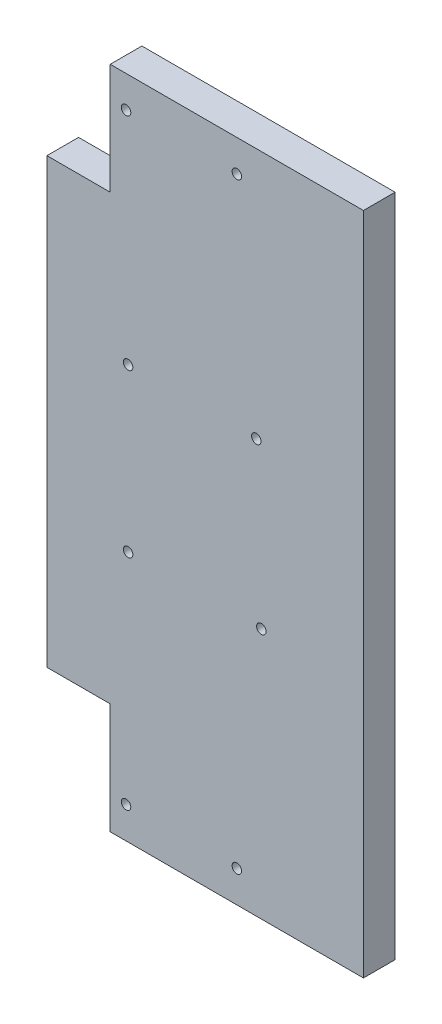
from build123d import *

# Parameters (mm, degrees)
ESQUISSE2_W             = 100
ESQUISSE2_H             = 210
BOSS_EXTRU_1_DEPTH      = 10
ESQUISSE3_W             = 20
ESQUISSE3_H             = 35
ENL_V_MAT_EXTRU_1_DEPTH = 10
ESQUISSE4_R             = 1.5
ENL_V_MAT_EXTRU_2_DEPTH = 10
ESQUISSE6_R             = 1.5
ENL_V_MAT_EXTRU_3_DEPTH = 10


with BuildPart() as part:
    # Esquisse2 → Boss.-Extru.1 (new body)
    with BuildSketch(Plane.XY):
        with Locations((50, 105)):
            Rectangle(ESQUISSE2_W, ESQUISSE2_H)
    extrude(amount=BOSS_EXTRU_1_DEPTH)

    # Esquisse3 → Enlèv. mat.-Extru.1 (cut)
    with BuildSketch(Plane.XY):
        with Locations((10, 192.5)):
            Rectangle(ESQUISSE3_W, ESQUISSE3_H)
        with Locations((10, 17.5)):
            Rectangle(ESQUISSE3_W, ESQUISSE3_H)
    extrude(amount=ENL_V_MAT_EXTRU_1_DEPTH, mode=Mode.SUBTRACT)

    # Esquisse4 → Enlèv. mat.-Extru.2 (cut)
    with BuildSketch(Plane(origin=(0, 0, 0), x_dir=(-1, 0, 0), z_dir=(0, 0, -1))):
        with Locations((-25, 200)):
            Circle(ESQUISSE4_R)
        with Locations((-60, 200)):
            Circle(ESQUISSE4_R)
        with Locations((-25, 10)):
            Circle(ESQUISSE4_R)
        with Locations((-60, 10)):
            Circle(ESQUISSE4_R)
    extrude(amount=-ENL_V_MAT_EXTRU_2_DEPTH, mode=Mode.SUBTRACT)

    # Esquisse6 → Enlèv. mat.-Extru.3 (cut)
    with BuildSketch(Plane(origin=(0, 0, 0), x_dir=(-1, 0, 0), z_dir=(0, 0, -1))):
        with Locations((-25.645889501, 130.633743079)):
            Circle(ESQUISSE6_R)
        with Locations((-25.645889501, 79.385925673)):
            Circle(ESQUISSE6_R)
        with Locations((-67.742251285, 79.385925673)):
            Circle(ESQUISSE6_R)
        with Locations((-66.161997433, 130.633743079)):
            Circle(ESQUISSE6_R)
    extrude(amount=-ENL_V_MAT_EXTRU_3_DEPTH, mode=Mode.SUBTRACT)


solid = part.part
